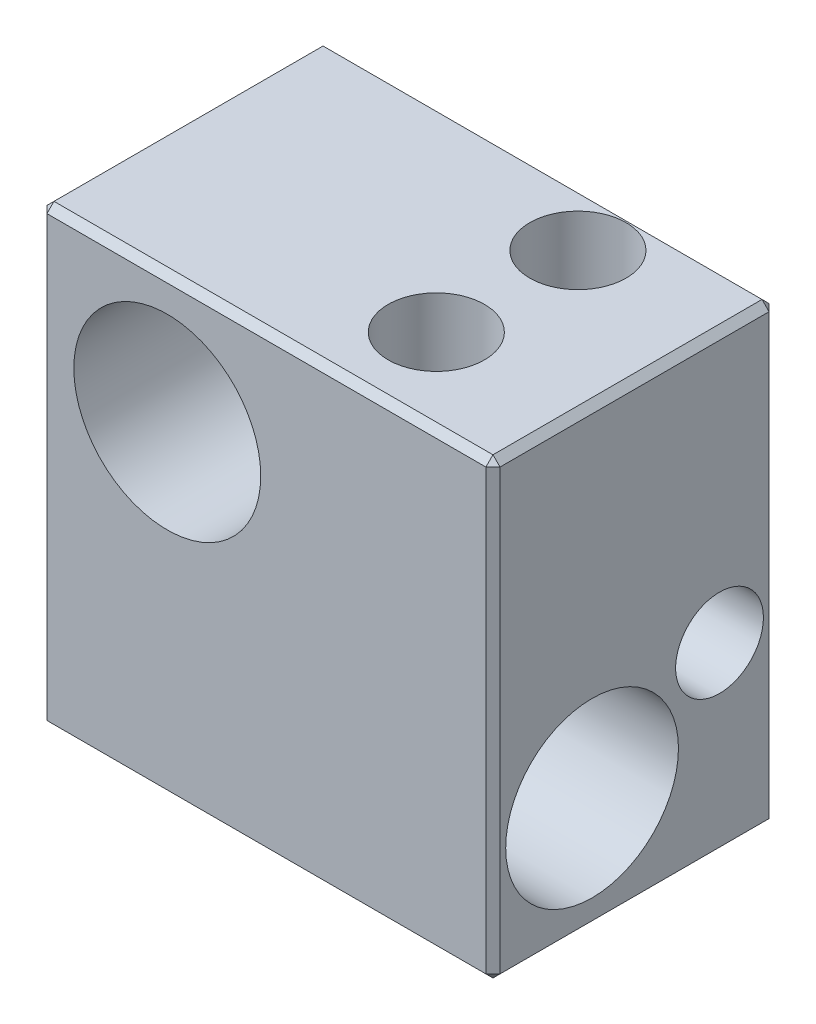
from build123d import *

# Parameters (mm, degrees)
ESQUISSE1_W                     = 16
ESQUISSE1_H                     = 16
BOSS_EXTRU_1_DEPTH              = 10
D_GAGEMENT_M61_D                = 6.6
DIAM_TRE_DU_PER_AGE_6_1_6_1_1_D = 6.1
DIAM_TRE_DU_PER_AGE_3_1_3_1_1_D = 3.1
D_GAGEMENT_M31_D                = 3.4
D_GAGEMENT_M31_DEPTH            = 11
D_GAGEMENT_M31_TIP              = 1.021463052
D_GAGEMENT_M33_D                = 3.4
D_GAGEMENT_M33_DEPTH            = 9.5
D_GAGEMENT_M33_TIP              = 1.021463052
CHANFREIN1_SIZE                 = 0.25


with BuildPart() as part:
    # Esquisse1 → Boss.-Extru.1 (new body)
    with BuildSketch(Plane.XY):
        with Locations((8, 8)):
            Rectangle(ESQUISSE1_W, ESQUISSE1_H)
    extrude(amount=BOSS_EXTRU_1_DEPTH)

    # Dégagement M61 (through all)
    with Locations(Plane.XY.offset(10)):
        with Locations((4.5, 11.5)):
            Hole(D_GAGEMENT_M61_D / 2)

    # Diamètre du perçage Ø6.1 (6.1)1 (through all)
    with Locations(Plane(origin=(16, 0, 0), x_dir=(0, 0, -1), z_dir=(1, 0, 0))):
        with Locations((-6.5, 4)):
            Hole(DIAM_TRE_DU_PER_AGE_6_1_6_1_1_D / 2)

    # Diamètre du perçage Ø3.1 (3.1)1 (through all)
    with Locations(Plane(origin=(16, 0, 0), x_dir=(0, 0, -1), z_dir=(1, 0, 0))):
        with Locations((-2, 6.5)):
            Hole(DIAM_TRE_DU_PER_AGE_3_1_3_1_1_D / 2)

    # Dégagement M31
    with Locations(Plane(origin=(0, 16, 0), x_dir=(1, 0, 0), z_dir=(0, 1, 0))):
        with Locations((11, -7)):
            Hole(D_GAGEMENT_M31_D / 2, depth=D_GAGEMENT_M31_DEPTH)
            with Locations((0, 0, -(D_GAGEMENT_M31_DEPTH + D_GAGEMENT_M31_TIP / 2))):  # 118° drill point
                Cone(0, D_GAGEMENT_M31_D / 2, D_GAGEMENT_M31_TIP, mode=Mode.SUBTRACT)

    # Dégagement M33
    with Locations(Plane(origin=(0, 16, 0), x_dir=(1, 0, 0), z_dir=(0, 1, 0))):
        with Locations((11, -2)):
            Hole(D_GAGEMENT_M33_D / 2, depth=D_GAGEMENT_M33_DEPTH)
            with Locations((0, 0, -(D_GAGEMENT_M33_DEPTH + D_GAGEMENT_M33_TIP / 2))):  # 118° drill point
                Cone(0, D_GAGEMENT_M33_D / 2, D_GAGEMENT_M33_TIP, mode=Mode.SUBTRACT)

    # Chanfrein1
    chanfrein1_edges = [part.edges().sort_by_distance(p)[0] for p in [
        (16, 8, 10),
        (8, 16, 10),
        (0, 8, 10),
        (8, 16, 0),
        (16, 8, 0),
        (8, 0, 0),
        (0, 8, 0),
        (8, 0, 10),
        (0, 16, 5),
        (16, 16, 5),
        (16, 0, 5),
        (0, 0, 5),
    ]]
    chamfer(chanfrein1_edges, length=CHANFREIN1_SIZE)


solid = part.part
